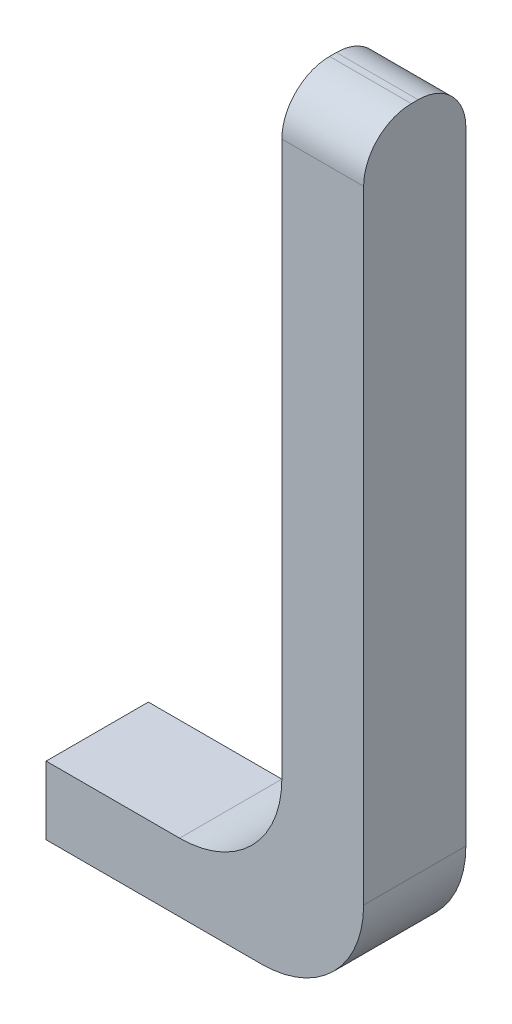
from build123d import *

# Parameters (mm, degrees)
BOSS_EXTRUDE1_DEPTH = 15
FILLET1_R           = 7


with BuildPart() as part:
    # Sketch1 → Boss-Extrude1 (new body)
    with BuildSketch(Plane.XY):
        with BuildLine():
            Line((81.814228499, 422.253610621), (101.396155955, 422.253610621))
            ThreePointArc((101.396155955, 422.253610621), (112.002757673, 426.647008903), (116.396155955, 437.253610621))
            Line((116.396155955, 437.253610621), (116.396155955, 525.576232013))
            Line((116.396155955, 525.576232013), (128.396155955, 525.576232013))
            Line((128.396155955, 525.576232013), (128.396155955, 427.253610621))
            ThreePointArc((128.396155955, 427.253610621), (124.002757673, 416.647008903), (113.396155955, 412.253610621))
            Line((113.396155955, 412.253610621), (81.814228499, 412.253610621))
            Line((81.814228499, 412.253610621), (81.814228499, 422.253610621))
        make_face()
    extrude(amount=-BOSS_EXTRUDE1_DEPTH)

    # Fillet1
    fillet1_edges = [part.edges().sort_by_distance(p)[0] for p in [
        (122.396155955, 525.576232013, -15),
        (122.396155955, 525.576232013, 0),
    ]]
    fillet(fillet1_edges, radius=FILLET1_R)


solid = part.part
